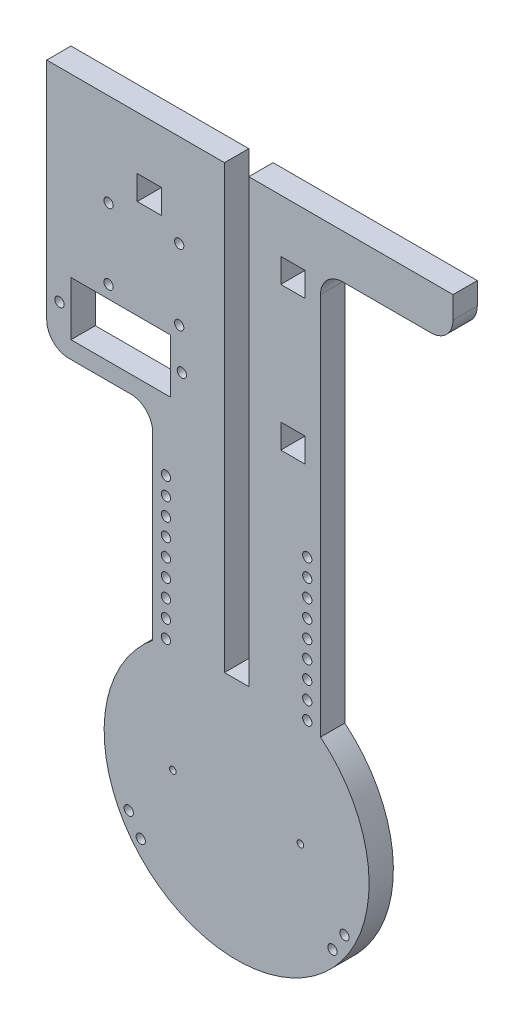
from build123d import *

# Parameters (mm, degrees)
EXTRUDE_1_DEPTH      = 5.5
SKETCH_5_R           = 0.75
CUT_EXTRUDE_3_DEPTH  = 135.373546504
SKETCH_6_R           = 1.05
CUT_EXTRUDE_4_DEPTH  = 135.373546504
SKETCH_8_W           = 5.5
SKETCH_8_H           = 5.5
CUT_EXTRUDE_6_DEPTH  = 135.373546504
SKETCH_9_R           = 1.05
CUT_EXTRUDE_7_DEPTH  = 135.373546504
SKETCH_10_W          = 5.5
SKETCH_10_H          = 100
CUT_EXTRUDE_8_DEPTH  = 135.373546504
SKETCH_11_R          = 1.05
CUT_EXTRUDE_9_DEPTH  = 135.373546504
SKETCH_12_R          = 1.05
SKETCH_12_W          = 22.5
SKETCH_12_H          = 12.2
CUT_EXTRUDE_10_DEPTH = 10
FILLET_1_R           = 5
FILLET_2_R           = 5


with BuildPart() as part:
    # ｽｹｯﾁ1 → ﾎﾞｽ - 押し出し1 (new body)
    with BuildSketch(Plane.XY):
        with BuildLine():
            Line((19, 125), (-43, 125))
            Line((-43, 125), (-43, 69))
            Line((-43, 69), (-19, 69))
            Line((-19, 69), (-19, 23.216373532))
            ThreePointArc((-19, 23.216373532), (0, -30), (19, 23.216373532))
            Line((19, 23.216373532), (19, 115))
            Line((19, 115), (49, 115))
            Line((49, 115), (49, 125))
            Line((49, 125), (19, 125))
        make_face()
    extrude(amount=EXTRUDE_1_DEPTH)

    # ｽｹｯﾁ5 → ｶｯﾄ - 押し出し3 (cut, through all)
    with BuildSketch(Plane.XY.offset(5.5)):
        with Locations((14.45, 0)):
            Circle(SKETCH_5_R)
        with Locations((-14.45, 0)):
            Circle(SKETCH_5_R)
    extrude(amount=-CUT_EXTRUDE_3_DEPTH, mode=Mode.SUBTRACT)

    # ｽｹｯﾁ6 → ｶｯﾄ - 押し出し4 (cut, through all)
    with BuildSketch(Plane.XY.offset(5.5)):
        with Locations((-24.425038206, -12.880897043)):
            Circle(SKETCH_6_R)
        with Locations((-21.701843031, -17.074249883)):
            Circle(SKETCH_6_R)
        with Locations(Location((24.425038206, -12.880897043, 0), (0, 0, 180))):
            Circle(SKETCH_6_R)
        with Locations(Location((21.701843031, -17.074249883, 0), (0, 0, 180))):
            Circle(SKETCH_6_R)
    extrude(amount=-CUT_EXTRUDE_4_DEPTH, mode=Mode.SUBTRACT)

    # ｽｹｯﾁ8 → ｶｯﾄ - 押し出し6 (cut, through all)
    with BuildSketch(Plane.XY.offset(5.5)):
        with Locations((12.75, 110.25)):
            Rectangle(SKETCH_8_W, SKETCH_8_H)
        with Locations((-19.75, 110.25)):
            Rectangle(SKETCH_8_W, SKETCH_8_H)
        with Locations((12.75, 77.75)):
            Rectangle(SKETCH_8_W, SKETCH_8_H)
    extrude(amount=-CUT_EXTRUDE_6_DEPTH, mode=Mode.SUBTRACT)

    # ｽｹｯﾁ9 → ｶｯﾄ - 押し出し7 (cut, through all)
    with BuildSketch(Plane.XY.offset(5.5)):
        with Locations((16, 25)):
            Circle(SKETCH_9_R)
        with Locations((16, 29)):
            Circle(SKETCH_9_R)
        with Locations((16, 33)):
            Circle(SKETCH_9_R)
        with Locations((16, 37)):
            Circle(SKETCH_9_R)
        with Locations((16, 41)):
            Circle(SKETCH_9_R)
        with Locations((16, 45)):
            Circle(SKETCH_9_R)
        with Locations((16, 49)):
            Circle(SKETCH_9_R)
        with Locations((16, 53)):
            Circle(SKETCH_9_R)
        with Locations((16, 57)):
            Circle(SKETCH_9_R)
        with Locations(Location((-16, 57, 0), (0, 0, 180))):
            Circle(SKETCH_9_R)
        with Locations(Location((-16, 53, 0), (0, 0, 180))):
            Circle(SKETCH_9_R)
        with Locations(Location((-16, 49, 0), (0, 0, 180))):
            Circle(SKETCH_9_R)
        with Locations(Location((-16, 45, 0), (0, 0, 180))):
            Circle(SKETCH_9_R)
        with Locations(Location((-16, 41, 0), (0, 0, 180))):
            Circle(SKETCH_9_R)
        with Locations(Location((-16, 37, 0), (0, 0, 180))):
            Circle(SKETCH_9_R)
        with Locations(Location((-16, 33, 0), (0, 0, 180))):
            Circle(SKETCH_9_R)
        with Locations(Location((-16, 29, 0), (0, 0, 180))):
            Circle(SKETCH_9_R)
        with Locations(Location((-16, 25, 0), (0, 0, 180))):
            Circle(SKETCH_9_R)
    extrude(amount=-CUT_EXTRUDE_7_DEPTH, mode=Mode.SUBTRACT)

    # ｽｹｯﾁ10 → ｶｯﾄ - 押し出し8 (cut, through all)
    with BuildSketch(Plane.XY.offset(5.5)):
        with Locations((0, 75)):
            Rectangle(SKETCH_10_W, SKETCH_10_H)
    extrude(amount=-CUT_EXTRUDE_8_DEPTH, mode=Mode.SUBTRACT)

    # ｽｹｯﾁ11 → ｶｯﾄ - 押し出し9 (cut, through all)
    with BuildSketch(Plane.XY.offset(5.5)):
        with Locations((-13, 104)):
            Circle(SKETCH_11_R)
        with Locations((-29, 104)):
            Circle(SKETCH_11_R)
        with Locations((-13, 88)):
            Circle(SKETCH_11_R)
        with Locations((-29, 88)):
            Circle(SKETCH_11_R)
    extrude(amount=-CUT_EXTRUDE_9_DEPTH, mode=Mode.SUBTRACT)

    # ｽｹｯﾁ12 → ｶｯﾄ - 押し出し10 (cut)
    with BuildSketch(Plane.XY.offset(5.5)):
        with Locations((-40.1, 79)):
            Circle(SKETCH_12_R)
        with Locations((-12.4, 79)):
            Circle(SKETCH_12_R)
        with Locations((-26.25, 79)):
            Rectangle(SKETCH_12_W, SKETCH_12_H)
    extrude(amount=-CUT_EXTRUDE_10_DEPTH, mode=Mode.SUBTRACT)

    # ﾌｨﾚｯﾄ1
    fillet_1_edges = [part.edges().sort_by_distance(p)[0] for p in [
        (-19, 69, 2.75),
        (-43, 69, 2.75),
    ]]
    fillet(fillet_1_edges, radius=FILLET_1_R)

    # ﾌｨﾚｯﾄ2
    fillet_2_edges = [part.edges().sort_by_distance(p)[0] for p in [
        (19, 115, 2.75),
        (49, 115, 2.75),
    ]]
    fillet(fillet_2_edges, radius=FILLET_2_R)


solid = part.part
